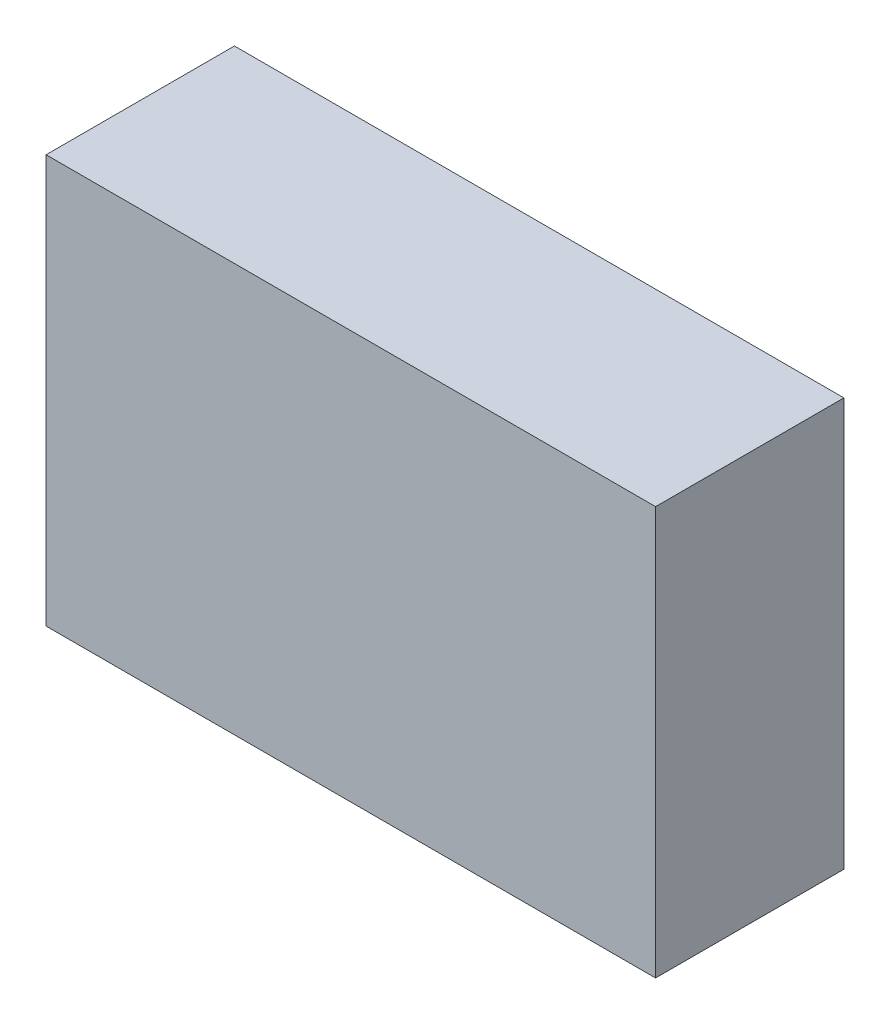
from build123d import *

# Parameters (mm, degrees)
SKETCH1_W           = 75.4
SKETCH1_H           = 50.5
BOSS_EXTRUDE1_DEPTH = 23.3


with BuildPart() as part:
    # Sketch1 → Boss-Extrude1 (new body)
    with BuildSketch(Plane.XY):
        with Locations((37.7, 25.25)):
            Rectangle(SKETCH1_W, SKETCH1_H)
    extrude(amount=BOSS_EXTRUDE1_DEPTH)


solid = part.part
